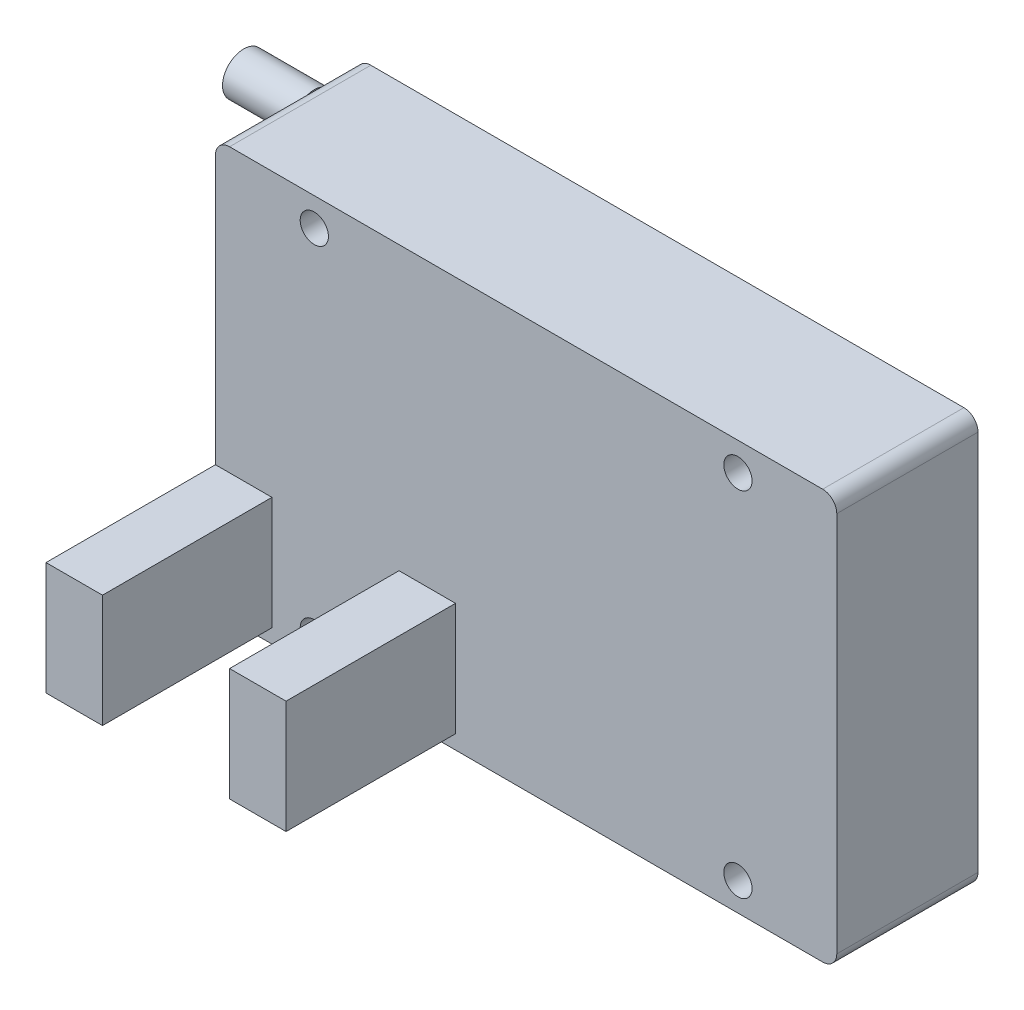
from build123d import *

# Parameters (mm, degrees)
BOSS_EXTRUDE1_DEPTH = 10
SKETCH2_R           = 1.5
BOSS_EXTRUDE2_DEPTH = 5
SKETCH3_W           = 4
SKETCH3_H           = 8
BOSS_EXTRUDE3_DEPTH = 12
SKETCH4_R           = 1
CUT_EXTRUDE1_DEPTH  = 38.725985739


with BuildPart() as part:
    # Sketch1 → Boss-Extrude1 (new body)
    with BuildSketch(Plane(origin=(0, 0, 0), x_dir=(0, 1, 0), z_dir=(0, 0, 1))):
        with BuildLine():
            Line((-13.5, 22), (13.5, 22))
            ThreePointArc((13.5, 22), (14.207106781, 21.707106781), (14.5, 21))
            Line((14.5, 21), (14.5, -21))
            ThreePointArc((14.5, -21), (14.207106781, -21.707106781), (13.5, -22))
            Line((13.5, -22), (-13.5, -22))
            ThreePointArc((-13.5, -22), (-14.207106781, -21.707106781), (-14.5, -21))
            Line((-14.5, -21), (-14.5, 21))
            ThreePointArc((-14.5, 21), (-14.207106781, 21.707106781), (-13.5, 22))
        make_face()
    extrude(amount=BOSS_EXTRUDE1_DEPTH)

    # Sketch2 → Boss-Extrude2 (add)
    with BuildSketch(Plane(origin=(-22, 0, 0), x_dir=(0, -1, 0), z_dir=(-1, 0, 0))):
        with Locations(Location((-12.5, 3, 0), (0, 0, 228.189685104))):
            Circle(SKETCH2_R)
        with Locations(Location((0.5, 3, 0), (0, 0, 270))):
            Circle(SKETCH2_R)
        with Locations(Location((6.5, 3, 0), (0, 0, 270))):
            Circle(SKETCH2_R)
        with Locations(Location((11.5, 3, 0), (0, 0, 270))):
            Circle(SKETCH2_R)
    extrude(amount=BOSS_EXTRUDE2_DEPTH)

    # Sketch3 → Boss-Extrude3 (add)
    with BuildSketch(Plane.XY.offset(10)):
        with Locations((-7, -9.5)):
            Rectangle(SKETCH3_W, SKETCH3_H)
        with Locations((-20, -9.5)):
            Rectangle(SKETCH3_W, SKETCH3_H)
    extrude(amount=BOSS_EXTRUDE3_DEPTH)

    # Sketch4 → Cut-Extrude1 (cut, through all)
    with BuildSketch(Plane(origin=(0, 0, 0), x_dir=(1, 0, 0), z_dir=(0, 0, -1))):
        with Locations(Location((-15, 12.5, 0), (0, 0, 180))):
            Circle(SKETCH4_R)
        with Locations(Location((15, 12.5, 0), (0, 0, 180))):
            Circle(SKETCH4_R)
        with Locations(Location((15, -12.5, 0), (0, 0, 180))):
            Circle(SKETCH4_R)
        with Locations(Location((-15, -12.5, 0), (0, 0, 180))):
            Circle(SKETCH4_R)
    extrude(amount=-CUT_EXTRUDE1_DEPTH, mode=Mode.SUBTRACT)


solid = part.part
